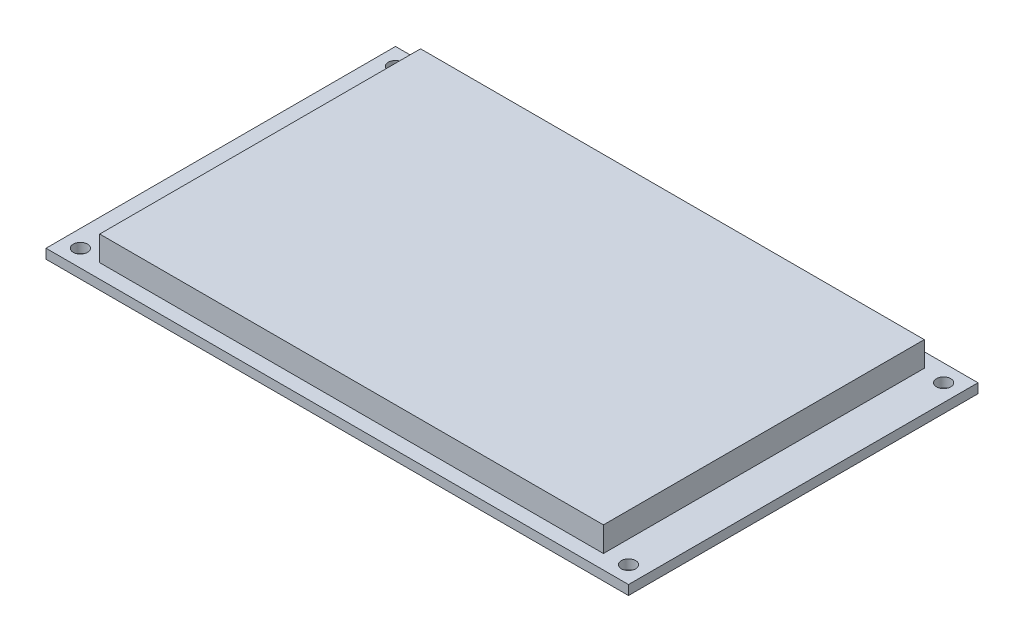
from build123d import *

# Parameters (mm, degrees)
SKETCH_1_W      = 122
SKETCH_1_H      = 73.2
SKETCH_1_R      = 1.5
EXTRUDE_1_DEPTH = 2
SKETCH_2_W      = 105.5
SKETCH_2_H      = 67.2
EXTRUDE_2_DEPTH = 5.2


with BuildPart() as part:
    # 草图1 → 凸台-拉伸1 (new body)
    with BuildSketch(Plane(origin=(0, 0, 0), x_dir=(1, 0, 0), z_dir=(0, 1, 0))):
        Rectangle(SKETCH_1_W, SKETCH_1_H)
        with Locations(Location((57.4, 33, 0), (0, 0, 270))):
            Circle(SKETCH_1_R, mode=Mode.SUBTRACT)
        with Locations(Location((57.4, -33, 0), (0, 0, 90))):
            Circle(SKETCH_1_R, mode=Mode.SUBTRACT)
        with Locations(Location((-57.4, -33, 0), (0, 0, 270))):
            Circle(SKETCH_1_R, mode=Mode.SUBTRACT)
        with Locations(Location((-57.4, 33, 0), (0, 0, 90))):
            Circle(SKETCH_1_R, mode=Mode.SUBTRACT)
    extrude(amount=EXTRUDE_1_DEPTH)

    # 草图2 → 凸台-拉伸2 (add)
    with BuildSketch(Plane(origin=(0, 2, 0), x_dir=(1, 0, 0), z_dir=(0, 1, 0))):
        Rectangle(SKETCH_2_W, SKETCH_2_H)
    extrude(amount=EXTRUDE_2_DEPTH)


solid = part.part
